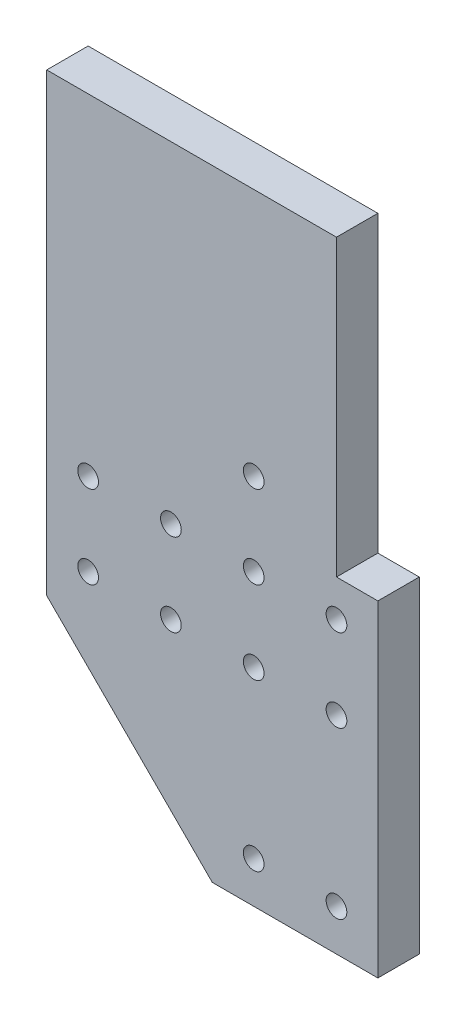
from build123d import *

# Parameters (mm, degrees)
BOSS_EXTRUDE1_DEPTH = 10
CUT_EXTRUDE1_REACH  = 157.563
SKETCH2_R           = 2.5


with BuildPart() as part:
    # Sketch1 → Boss-Extrude1 (new body)
    with BuildSketch(Plane.XY):
        Polygon((0, 0), (40, 0), (40, 78.89880614), (30, 78.89880614), (30, 150), (-40, 150), (-40, 80), (-40, 40), align=None)
    extrude(amount=BOSS_EXTRUDE1_DEPTH)

    # Sketch2 → Cut-Extrude1 (cut, up to next)
    with BuildSketch(Plane.XY.offset(10), mode=Mode.PRIVATE) as cut_extrude1_sk1:
        with Locations((-30, 70)):
            Circle(SKETCH2_R)
    cut_extrude1_tool1 = extrude(cut_extrude1_sk1.sketch, amount=-CUT_EXTRUDE1_REACH, mode=Mode.PRIVATE) & part.part
    # Sketch2 → Cut-Extrude1 (cut, up to next)
    with BuildSketch(Plane.XY.offset(10), mode=Mode.PRIVATE) as cut_extrude1_sk2:
        with Locations((-10, 70)):
            Circle(SKETCH2_R)
    cut_extrude1_tool2 = extrude(cut_extrude1_sk2.sketch, amount=-CUT_EXTRUDE1_REACH, mode=Mode.PRIVATE) & part.part
    # Sketch2 → Cut-Extrude1 (cut, up to next)
    with BuildSketch(Plane.XY.offset(10), mode=Mode.PRIVATE) as cut_extrude1_sk3:
        with Locations((-30, 50)):
            Circle(SKETCH2_R)
    cut_extrude1_tool3 = extrude(cut_extrude1_sk3.sketch, amount=-CUT_EXTRUDE1_REACH, mode=Mode.PRIVATE) & part.part
    # Sketch2 → Cut-Extrude1 (cut, up to next)
    with BuildSketch(Plane.XY.offset(10), mode=Mode.PRIVATE) as cut_extrude1_sk4:
        with Locations((-10, 50)):
            Circle(SKETCH2_R)
    cut_extrude1_tool4 = extrude(cut_extrude1_sk4.sketch, amount=-CUT_EXTRUDE1_REACH, mode=Mode.PRIVATE) & part.part
    # Sketch2 → Cut-Extrude1 (cut, up to next)
    with BuildSketch(Plane.XY.offset(10), mode=Mode.PRIVATE) as cut_extrude1_sk5:
        with Locations((10, 50)):
            Circle(SKETCH2_R)
    cut_extrude1_tool5 = extrude(cut_extrude1_sk5.sketch, amount=-CUT_EXTRUDE1_REACH, mode=Mode.PRIVATE) & part.part
    # Sketch2 → Cut-Extrude1 (cut, up to next)
    with BuildSketch(Plane.XY.offset(10), mode=Mode.PRIVATE) as cut_extrude1_sk6:
        with Locations((30, 50)):
            Circle(SKETCH2_R)
    cut_extrude1_tool6 = extrude(cut_extrude1_sk6.sketch, amount=-CUT_EXTRUDE1_REACH, mode=Mode.PRIVATE) & part.part
    # Sketch2 → Cut-Extrude1 (cut, up to next)
    with BuildSketch(Plane.XY.offset(10), mode=Mode.PRIVATE) as cut_extrude1_sk7:
        with Locations((10, 10)):
            Circle(SKETCH2_R)
    cut_extrude1_tool7 = extrude(cut_extrude1_sk7.sketch, amount=-CUT_EXTRUDE1_REACH, mode=Mode.PRIVATE) & part.part
    # Sketch2 → Cut-Extrude1 (cut, up to next)
    with BuildSketch(Plane.XY.offset(10), mode=Mode.PRIVATE) as cut_extrude1_sk8:
        with Locations((30, 10)):
            Circle(SKETCH2_R)
    cut_extrude1_tool8 = extrude(cut_extrude1_sk8.sketch, amount=-CUT_EXTRUDE1_REACH, mode=Mode.PRIVATE) & part.part
    # Sketch2 → Cut-Extrude1 (cut, up to next)
    with BuildSketch(Plane.XY.offset(10), mode=Mode.PRIVATE) as cut_extrude1_sk9:
        with Locations((10, 90)):
            Circle(SKETCH2_R)
    cut_extrude1_tool9 = extrude(cut_extrude1_sk9.sketch, amount=-CUT_EXTRUDE1_REACH, mode=Mode.PRIVATE) & part.part
    # Sketch2 → Cut-Extrude1 (cut, up to next)
    with BuildSketch(Plane.XY.offset(10), mode=Mode.PRIVATE) as cut_extrude1_sk10:
        with Locations((10, 70)):
            Circle(SKETCH2_R)
    cut_extrude1_tool10 = extrude(cut_extrude1_sk10.sketch, amount=-CUT_EXTRUDE1_REACH, mode=Mode.PRIVATE) & part.part
    # Sketch2 → Cut-Extrude1 (cut, up to next)
    with BuildSketch(Plane.XY.offset(10), mode=Mode.PRIVATE) as cut_extrude1_sk11:
        with Locations((30, 70)):
            Circle(SKETCH2_R)
    cut_extrude1_tool11 = extrude(cut_extrude1_sk11.sketch, amount=-CUT_EXTRUDE1_REACH, mode=Mode.PRIVATE) & part.part
    add(cut_extrude1_tool1.solids().sort_by_distance((-30, 70, 10))[0], mode=Mode.SUBTRACT)
    add(cut_extrude1_tool2.solids().sort_by_distance((-10, 70, 10))[0], mode=Mode.SUBTRACT)
    add(cut_extrude1_tool3.solids().sort_by_distance((-30, 50, 10))[0], mode=Mode.SUBTRACT)
    add(cut_extrude1_tool4.solids().sort_by_distance((-10, 50, 10))[0], mode=Mode.SUBTRACT)
    add(cut_extrude1_tool5.solids().sort_by_distance((10, 50, 10))[0], mode=Mode.SUBTRACT)
    add(cut_extrude1_tool6.solids().sort_by_distance((30, 50, 10))[0], mode=Mode.SUBTRACT)
    add(cut_extrude1_tool7.solids().sort_by_distance((10, 10, 10))[0], mode=Mode.SUBTRACT)
    add(cut_extrude1_tool8.solids().sort_by_distance((30, 10, 10))[0], mode=Mode.SUBTRACT)
    add(cut_extrude1_tool9.solids().sort_by_distance((10, 90, 10))[0], mode=Mode.SUBTRACT)
    add(cut_extrude1_tool10.solids().sort_by_distance((10, 70, 10))[0], mode=Mode.SUBTRACT)
    add(cut_extrude1_tool11.solids().sort_by_distance((30, 70, 10))[0], mode=Mode.SUBTRACT)


solid = part.part
